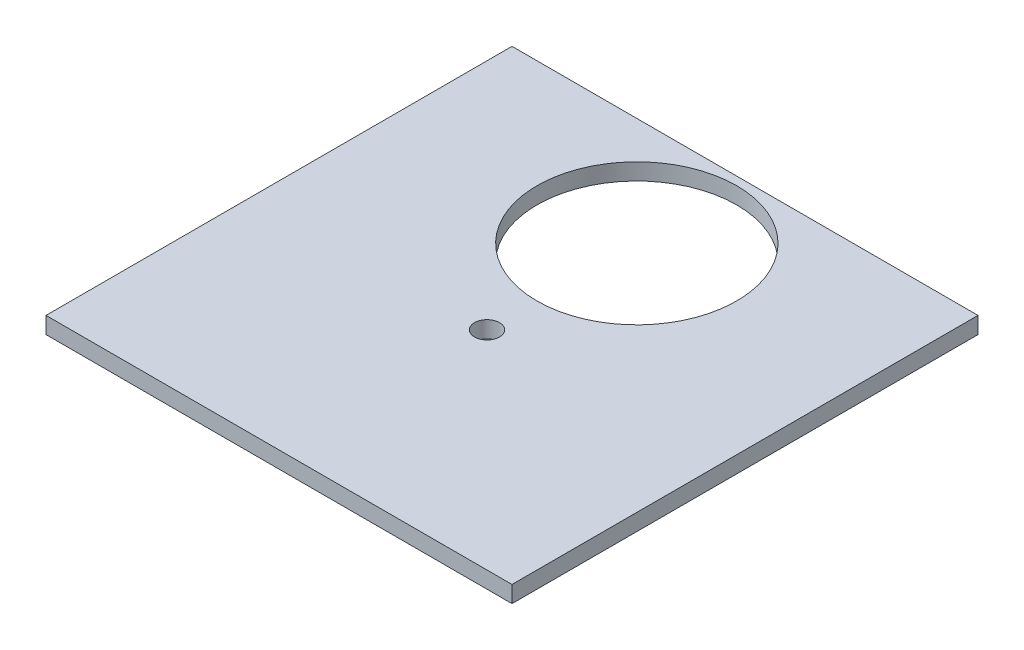
from build123d import *

# Parameters (mm, degrees)
SKETCH1_W           = 71.12
SKETCH1_H           = 71.12
BOSS_EXTRUDE1_DEPTH = 2.54
SKETCH2_R           = 15.24
CUT_EXTRUDE1_DEPTH  = 15.748
SKETCH4_R           = 1.905
CUT_EXTRUDE2_DEPTH  = 15.748


with BuildPart() as part:
    # Sketch1 → Boss-Extrude1 (new body)
    with BuildSketch(Plane(origin=(0, 0, 0), x_dir=(1, 0, 0), z_dir=(0, 1, 0))):
        with Locations((10.146850495, 4.656355231)):
            Rectangle(SKETCH1_W, SKETCH1_H)
    extrude(amount=-BOSS_EXTRUDE1_DEPTH)

    # Sketch2 → Cut-Extrude1 (cut)
    with BuildSketch(Plane(origin=(0, 0, 0), x_dir=(1, 0, 0), z_dir=(0, 1, 0))):
        with Locations(Location((10.146850495, 23.706355231, 0), (0, 0, 270))):
            Circle(SKETCH2_R)
    extrude(amount=-CUT_EXTRUDE1_DEPTH, mode=Mode.SUBTRACT)

    # Sketch4 → Cut-Extrude2 (cut)
    with BuildSketch(Plane(origin=(0, 0, 0), x_dir=(1, 0, 0), z_dir=(0, 1, 0))):
        with Locations(Location((10.146850495, 0.846355231, 0), (0, 0, 270))):
            Circle(SKETCH4_R)
    extrude(amount=-CUT_EXTRUDE2_DEPTH, mode=Mode.SUBTRACT)


solid = part.part
